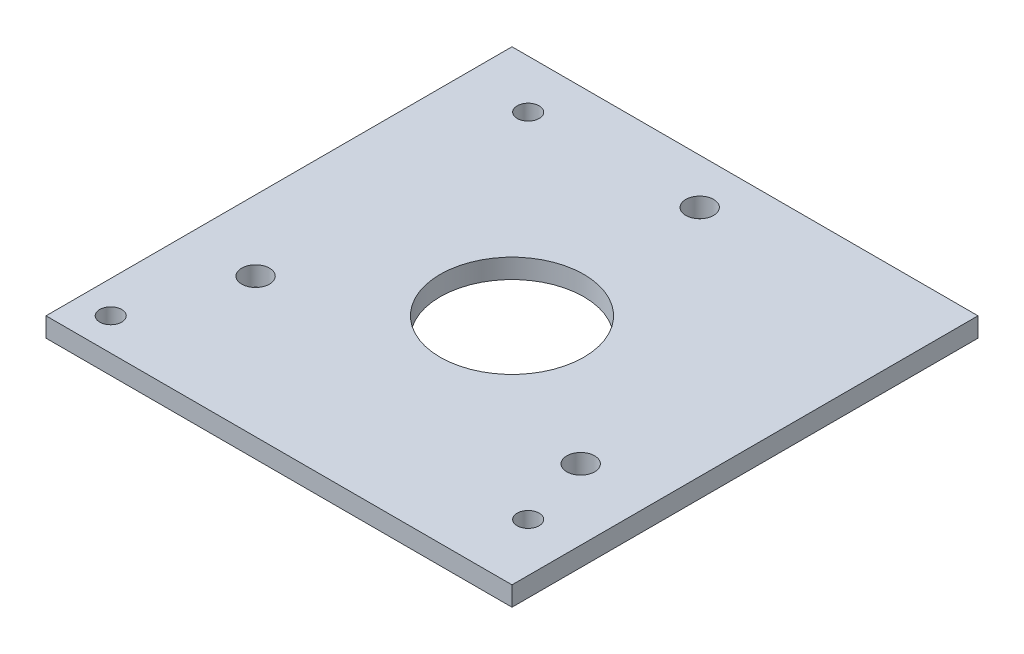
from build123d import *

# Parameters (mm, degrees)
SKETCH_3_W      = 72
SKETCH_3_H      = 72
SKETCH_3_R      = 11.1
SKETCH_3_R_2    = 2.15
SKETCH_3_R_3    = 1.7
EXTRUDE_1_DEPTH = 3


with BuildPart() as part:
    # 草图3 → 凸台-拉伸1 (new body)
    with BuildSketch(Plane(origin=(0, 0, 0), x_dir=(1, 0, 0), z_dir=(0, 1, 0))):
        Rectangle(SKETCH_3_W, SKETCH_3_H)
        with Locations(Location((0, 0, 0), (0, 0, 270))):
            Circle(SKETCH_3_R, mode=Mode.SUBTRACT)
        with Locations(Location((0, 29, 0), (0, 0, 270))):
            Circle(SKETCH_3_R_2, mode=Mode.SUBTRACT)
        with Locations(Location((25.11473671, -14.5, 0), (0, 0, 270))):
            Circle(SKETCH_3_R_2, mode=Mode.SUBTRACT)
        with Locations(Location((-25.11473671, -14.5, 0), (0, 0, 270))):
            Circle(SKETCH_3_R_2, mode=Mode.SUBTRACT)
        with Locations(Location((-26, 28.5, 0), (0, 0, 270))):
            Circle(SKETCH_3_R_3, mode=Mode.SUBTRACT)
        with Locations(Location((-31, -31, 0), (0, 0, 270))):
            Circle(SKETCH_3_R_3, mode=Mode.SUBTRACT)
        with Locations(Location((28.5, -26, 0), (0, 0, 270))):
            Circle(SKETCH_3_R_3, mode=Mode.SUBTRACT)
    extrude(amount=EXTRUDE_1_DEPTH)


solid = part.part
